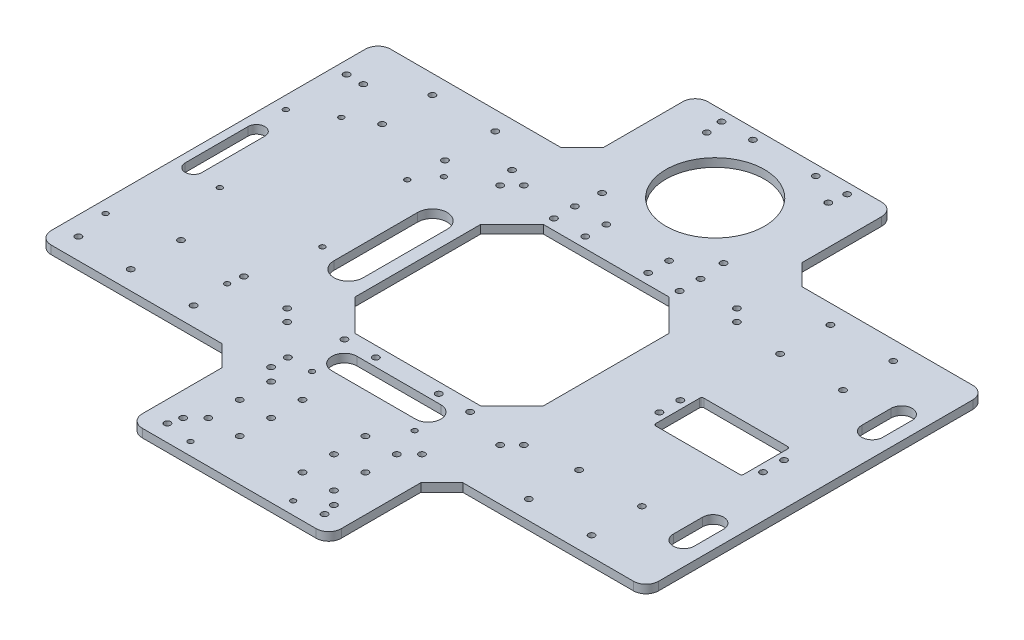
from build123d import *

# Parameters (mm, degrees)
EXTRUDE_1_DEPTH      = 4
SKETCH_2_R           = 1.5
CUT_EXTRUDE_1_DEPTH  = 4
SKETCH_3_R           = 23.5
SKETCH_3_R_2         = 1.5
CUT_EXTRUDE_2_DEPTH  = 4
SKETCH_4_W           = 90
SKETCH_4_H           = 90
CUT_EXTRUDE_3_DEPTH  = 4
FILLET_3_R           = 6
CHAMFER_1_SIZE       = 10
CUT_EXTRUDE_6_DEPTH  = 4
CHAMFER_2_SIZE       = 15
SKETCH_8_R           = 1.5
CUT_EXTRUDE_7_DEPTH  = 4
SKETCH_9_R           = 1.5
CUT_EXTRUDE_8_DEPTH  = 4
CUT_EXTRUDE_9_DEPTH  = 10
SKETCH_14_R          = 1.5
SKETCH_14_R_2        = 1.25
CUT_EXTRUDE_10_DEPTH = 10
SKETCH_15_R          = 1.5
SKETCH_15_W          = 42
SKETCH_15_H          = 23
CUT_EXTRUDE_11_DEPTH = 10
FILLET_4_R           = 1
SKETCH_16_R          = 1.25
CUT_EXTRUDE_12_DEPTH = 10
SKETCH_23_R          = 1.25
CUT_EXTRUDE_14_DEPTH = 10
SKETCH_24_R          = 1.5
CUT_EXTRUDE_15_DEPTH = 10
SKETCH_20_R          = 1.5
CUT_EXTRUDE_16_DEPTH = 10
SKETCH_26_R          = 1.5
CUT_EXTRUDE_17_DEPTH = 10


with BuildPart() as part:
    # 草图1 → 凸台-拉伸1 (new body)
    with BuildSketch(Plane(origin=(0, 0, 0), x_dir=(1, 0, 0), z_dir=(0, 1, 0))):
        Polygon((-47.5, -81), (-47.5, -135), (47.5, -135), (47.5, -81), (145, -81), (145, 81), (47.5, 81), (47.5, 135), (-47.5, 135), (-47.5, 81), (-145, 81), (-145, -81), align=None)
    extrude(amount=EXTRUDE_1_DEPTH)

    # 草图2 → 切除-拉伸1 (cut)
    with BuildSketch(Plane(origin=(0, 4, 0), x_dir=(1, 0, 0), z_dir=(0, 1, 0))):
        with Locations(Location((110, 72, 0), (0, 0, 270))):
            Circle(SKETCH_2_R)
        with Locations(Location((80, 72, 0), (0, 0, 270))):
            Circle(SKETCH_2_R)
        with Locations(Location((80, 48, 0), (0, 0, 270))):
            Circle(SKETCH_2_R)
        with Locations(Location((110, 48, 0), (0, 0, 270))):
            Circle(SKETCH_2_R)
        with Locations(Location((110, -48, 0), (0, 0, 90))):
            Circle(SKETCH_2_R)
        with Locations(Location((110, -72, 0), (0, 0, 90))):
            Circle(SKETCH_2_R)
        with Locations(Location((80, -48, 0), (0, 0, 90))):
            Circle(SKETCH_2_R)
        with Locations(Location((80, -72, 0), (0, 0, 90))):
            Circle(SKETCH_2_R)
        with Locations(Location((-80, -72, 0), (0, 0, 270))):
            Circle(SKETCH_2_R)
        with Locations(Location((-80, -48, 0), (0, 0, 270))):
            Circle(SKETCH_2_R)
        with Locations(Location((-110, -72, 0), (0, 0, 270))):
            Circle(SKETCH_2_R)
        with Locations(Location((-110, -48, 0), (0, 0, 270))):
            Circle(SKETCH_2_R)
        with Locations(Location((-110, 48, 0), (0, 0, 90))):
            Circle(SKETCH_2_R)
        with Locations(Location((-80, 48, 0), (0, 0, 90))):
            Circle(SKETCH_2_R)
        with Locations(Location((-80, 72, 0), (0, 0, 90))):
            Circle(SKETCH_2_R)
        with Locations(Location((-110, 72, 0), (0, 0, 90))):
            Circle(SKETCH_2_R)
    extrude(amount=-CUT_EXTRUDE_1_DEPTH, mode=Mode.SUBTRACT)

    # 草图3 → 切除-拉伸2 (cut)
    with BuildSketch(Plane(origin=(0, 4, 0), x_dir=(1, 0, 0), z_dir=(0, 1, 0))):
        with Locations(Location((0, 97, 0), (0, 0, 270))):
            Circle(SKETCH_3_R)
        with Locations(Location((29, 122, 0), (0, 0, 270))):
            Circle(SKETCH_3_R_2)
        with Locations(Location((29, 72, 0), (0, 0, 90))):
            Circle(SKETCH_3_R_2)
        with Locations(Location((-29, 72, 0), (0, 0, 270))):
            Circle(SKETCH_3_R_2)
        with Locations(Location((-29, 122, 0), (0, 0, 90))):
            Circle(SKETCH_3_R_2)
    extrude(amount=-CUT_EXTRUDE_2_DEPTH, mode=Mode.SUBTRACT)

    # 草图4 → 切除-拉伸3 (cut)
    with BuildSketch(Plane(origin=(0, 4, 0), x_dir=(1, 0, 0), z_dir=(0, 1, 0))):
        Rectangle(SKETCH_4_W, SKETCH_4_H)
    extrude(amount=-CUT_EXTRUDE_3_DEPTH, mode=Mode.SUBTRACT)

    # 圆角3
    fillet_3_edges = [part.edges().sort_by_distance(p)[0] for p in [
        (-145, 2, 81),
        (-145, 2, -81),
        (-47.5, 2, -135),
        (47.5, 2, -135),
        (145, 2, -81),
        (145, 2, 81),
        (47.5, 2, 135),
        (-47.5, 2, 135),
    ]]
    fillet(fillet_3_edges, radius=FILLET_3_R)

    # 倒角1
    chamfer_1_edges = [part.edges().sort_by_distance(p)[0] for p in [
        (-47.5, 2, 81),
        (-47.5, 2, -81),
        (47.5, 2, -81),
        (47.5, 2, 81),
    ]]
    chamfer(chamfer_1_edges, length=CHAMFER_1_SIZE)

    # 草图7 → 切除-拉伸6 (cut)
    with BuildSketch(Plane(origin=(0, 4, 0), x_dir=(1, 0, 0), z_dir=(0, 1, 0))):
        with BuildLine():
            Line((-65, -20), (-65, 20))
            ThreePointArc((-65, 20), (-58, 27), (-51, 20))
            Line((-51, 20), (-51, -20))
            ThreePointArc((-51, -20), (-58, -27), (-65, -20))
        make_face()
        with BuildLine():
            Line((-141, -15), (-141, 15))
            ThreePointArc((-141, 15), (-137, 19), (-133, 15))
            Line((-133, 15), (-133, -15))
            ThreePointArc((-133, -15), (-137, -19), (-141, -15))
        make_face()
        with BuildLine():
            Line((129, 38), (129, 52))
            ThreePointArc((129, 52), (134, 57), (139, 52))
            Line((139, 52), (139, 38))
            ThreePointArc((139, 38), (134, 33), (129, 38))
        make_face()
        with BuildLine():
            Line((129, -38), (129, -52))
            ThreePointArc((129, -52), (134, -57), (139, -52))
            Line((139, -52), (139, -38))
            ThreePointArc((139, -38), (134, -33), (129, -38))
        make_face()
    extrude(amount=-CUT_EXTRUDE_6_DEPTH, mode=Mode.SUBTRACT)

    # 倒角2
    chamfer_2_edges = [part.edges().sort_by_distance(p)[0] for p in [
        (45, 2, -45),
        (45, 2, 45),
        (-45, 2, 45),
        (-45, 2, -45),
    ]]
    chamfer(chamfer_2_edges, length=CHAMFER_2_SIZE)

    # 草图8 → 切除-拉伸7 (cut)
    with BuildSketch(Plane(origin=(0, 4, 0), x_dir=(1, 0, 0), z_dir=(0, 1, 0))):
        with Locations(Location((-139, 60, 0), (0, 0, 270))):
            Circle(SKETCH_8_R)
        with Locations(Location((-131, 60, 0), (0, 0, 270))):
            Circle(SKETCH_8_R)
    extrude(amount=-CUT_EXTRUDE_7_DEPTH, mode=Mode.SUBTRACT)

    # 草图9 → 切除-拉伸8 (cut)
    with BuildSketch(Plane(origin=(0, 4, 0), x_dir=(1, 0, 0), z_dir=(0, 1, 0))):
        with Locations(Location((50.843145751, 56.5, 0), (0, 0, 270))):
            Circle(SKETCH_9_R)
        with Locations(Location((56.5, 50.843145751, 0), (0, 0, 270))):
            Circle(SKETCH_9_R)
        with Locations(Location((56.5, -50.843145751, 0), (0, 0, 90))):
            Circle(SKETCH_9_R)
        with Locations(Location((50.843145751, -56.5, 0), (0, 0, 90))):
            Circle(SKETCH_9_R)
        with Locations(Location((-50.843145751, -56.5, 0), (0, 0, 270))):
            Circle(SKETCH_9_R)
        with Locations(Location((-56.5, -50.843145751, 0), (0, 0, 270))):
            Circle(SKETCH_9_R)
        with Locations(Location((-56.5, 50.843145751, 0), (0, 0, 90))):
            Circle(SKETCH_9_R)
        with Locations(Location((-50.843145751, 56.5, 0), (0, 0, 90))):
            Circle(SKETCH_9_R)
        with Locations(Location((-37.5, -127, 0), (0, 0, 270))):
            Circle(SKETCH_9_R)
        with Locations(Location((37.5, -127, 0), (0, 0, 90))):
            Circle(SKETCH_9_R)
    extrude(amount=-CUT_EXTRUDE_8_DEPTH, mode=Mode.SUBTRACT)

    # 草图12 → 切除-拉伸9 (cut)
    with BuildSketch(Plane(origin=(0, 4, 0), x_dir=(1, 0, 0), z_dir=(0, 1, 0))):
        with BuildLine():
            Line((-20, -54), (20, -54))
            ThreePointArc((20, -54), (26, -60), (20, -66))
            Line((20, -66), (-20, -66))
            ThreePointArc((-20, -66), (-26, -60), (-20, -54))
        make_face()
    extrude(amount=-CUT_EXTRUDE_9_DEPTH, mode=Mode.SUBTRACT)

    # 草图14 → 切除-拉伸10 (cut)
    with BuildSketch(Plane(origin=(0, 4, 0), x_dir=(1, 0, 0), z_dir=(0, 1, 0))):
        with Locations(Location((36, -79, 0), (0, 0, 270))):
            Circle(SKETCH_14_R)
        with Locations(Location((36, -121, 0), (0, 0, 270))):
            Circle(SKETCH_14_R)
        with Locations(Location((-36, -121, 0), (0, 0, 270))):
            Circle(SKETCH_14_R)
        with Locations(Location((-36, -79, 0), (0, 0, 270))):
            Circle(SKETCH_14_R)
        with Locations(Location((-24.5, -71, 0), (0, 0, 270))):
            Circle(SKETCH_14_R_2)
        with Locations(Location((24.5, -71, 0), (0, 0, 270))):
            Circle(SKETCH_14_R_2)
        with Locations(Location((24.5, -129, 0), (0, 0, 270))):
            Circle(SKETCH_14_R_2)
        with Locations(Location((-24.5, -129, 0), (0, 0, 270))):
            Circle(SKETCH_14_R_2)
    extrude(amount=-CUT_EXTRUDE_10_DEPTH, mode=Mode.SUBTRACT)

    # 草图15 → 切除-拉伸11 (cut)
    with BuildSketch(Plane(origin=(0, 4, 0), x_dir=(1, 0, 0), z_dir=(0, 1, 0))):
        with Locations(Location((75.36, 5, 0), (0, 0, 270))):
            Circle(SKETCH_15_R)
        with Locations(Location((75.36, -5, 0), (0, 0, 270))):
            Circle(SKETCH_15_R)
        with Locations(Location((124.86, -5, 0), (0, 0, 270))):
            Circle(SKETCH_15_R)
        with Locations(Location((124.86, 5, 0), (0, 0, 270))):
            Circle(SKETCH_15_R)
        with Locations((100.11, 0)):
            Rectangle(SKETCH_15_W, SKETCH_15_H)
    extrude(amount=-CUT_EXTRUDE_11_DEPTH, mode=Mode.SUBTRACT)

    # 圆角4
    fillet_4_edges = [part.edges().sort_by_distance(p)[0] for p in [
        (121.11, 2, -11.5),
        (121.11, 2, 11.5),
        (79.11, 2, 11.5),
        (79.11, 2, -11.5),
    ]]
    fillet(fillet_4_edges, radius=FILLET_4_R)

    # 草图16 → 切除-拉伸12 (cut)
    with BuildSketch(Plane(origin=(0, 4, 0), x_dir=(1, 0, 0), z_dir=(0, 1, 0))):
        with Locations(Location((-73.5, 41, 0), (0, 0, 270))):
            Circle(SKETCH_16_R)
        with Locations(Location((-122.5, 41, 0), (0, 0, 270))):
            Circle(SKETCH_16_R)
        with Locations(Location((-73.5, -17, 0), (0, 0, 270))):
            Circle(SKETCH_16_R)
        with Locations(Location((-122.5, -17, 0), (0, 0, 270))):
            Circle(SKETCH_16_R)
    extrude(amount=-CUT_EXTRUDE_12_DEPTH, mode=Mode.SUBTRACT)

    # 草图23 → 切除-拉伸14 (cut)
    with BuildSketch(Plane(origin=(0, 4, 0), x_dir=(1, 0, 0), z_dir=(0, 1, 0))):
        with Locations(Location((-81, 31, 0), (0, 0, 270))):
            Circle(SKETCH_23_R)
        with Locations(Location((-139, 31, 0), (0, 0, 270))):
            Circle(SKETCH_23_R)
        with Locations(Location((-81, -55, 0), (0, 0, 270))):
            Circle(SKETCH_23_R)
        with Locations(Location((-139, -55, 0), (0, 0, 270))):
            Circle(SKETCH_23_R)
    extrude(amount=-CUT_EXTRUDE_14_DEPTH, mode=Mode.SUBTRACT)

    # 草图24 → 切除-拉伸15 (cut)
    with BuildSketch(Plane(origin=(0, 4, 0), x_dir=(1, 0, 0), z_dir=(0, 1, 0))):
        with Locations(Location((-136, -71, 0), (0, 0, 270))):
            Circle(SKETCH_24_R)
        with Locations(Location((-36, -71, 0), (0, 0, 270))):
            Circle(SKETCH_24_R)
        with Locations(Location((-36, -121, 0), (0, 0, 270))):
            Circle(SKETCH_24_R)
    extrude(amount=-CUT_EXTRUDE_15_DEPTH, mode=Mode.SUBTRACT)

    # 草图20 → 切除-拉伸16 (cut)
    with BuildSketch(Plane(origin=(0, 4, 0), x_dir=(1, 0, 0), z_dir=(0, 1, 0))):
        with Locations(Location((-60, 60, 0), (0, 0, 270))):
            Circle(SKETCH_20_R)
    extrude(amount=-CUT_EXTRUDE_16_DEPTH, mode=Mode.SUBTRACT)

    # 草图26 → 切除-拉伸17 (cut)
    with BuildSketch(Plane(origin=(0, 4, 0), x_dir=(1, 0, 0), z_dir=(0, 1, 0))):
        with Locations(Location((-30, -115, 0), (0, 0, 270))):
            Circle(SKETCH_26_R)
        with Locations(Location((-30, -100, 0), (0, 0, 270))):
            Circle(SKETCH_26_R)
        with Locations(Location((-15, -100, 0), (0, 0, 270))):
            Circle(SKETCH_26_R)
        with Locations(Location((-15, -115, 0), (0, 0, 270))):
            Circle(SKETCH_26_R)
        with Locations(Location((15, -115, 0), (0, 0, 270))):
            Circle(SKETCH_26_R)
        with Locations(Location((30, -115, 0), (0, 0, 270))):
            Circle(SKETCH_26_R)
        with Locations(Location((15, -100, 0), (0, 0, 270))):
            Circle(SKETCH_26_R)
        with Locations(Location((30, -100, 0), (0, 0, 270))):
            Circle(SKETCH_26_R)
        with Locations(Location((-30, -85, 0), (0, 0, 270))):
            Circle(SKETCH_26_R)
        with Locations(Location((-15, -85, 0), (0, 0, 270))):
            Circle(SKETCH_26_R)
        with Locations(Location((15, -85, 0), (0, 0, 270))):
            Circle(SKETCH_26_R)
        with Locations(Location((30, -85, 0), (0, 0, 270))):
            Circle(SKETCH_26_R)
        with Locations(Location((-30, -50, 0), (0, 0, 270))):
            Circle(SKETCH_26_R)
        with Locations(Location((-15, -50, 0), (0, 0, 270))):
            Circle(SKETCH_26_R)
        with Locations(Location((15, -50, 0), (0, 0, 270))):
            Circle(SKETCH_26_R)
        with Locations(Location((30, -50, 0), (0, 0, 270))):
            Circle(SKETCH_26_R)
        with Locations(Location((-30, 50, 0), (0, 0, 270))):
            Circle(SKETCH_26_R)
        with Locations(Location((-15, 50, 0), (0, 0, 270))):
            Circle(SKETCH_26_R)
        with Locations(Location((15, 50, 0), (0, 0, 270))):
            Circle(SKETCH_26_R)
        with Locations(Location((30, 50, 0), (0, 0, 270))):
            Circle(SKETCH_26_R)
        with Locations(Location((-30, 60, 0), (0, 0, 270))):
            Circle(SKETCH_26_R)
        with Locations(Location((-15, 60, 0), (0, 0, 270))):
            Circle(SKETCH_26_R)
        with Locations(Location((15, 60, 0), (0, 0, 270))):
            Circle(SKETCH_26_R)
        with Locations(Location((30, 60, 0), (0, 0, 270))):
            Circle(SKETCH_26_R)
        with Locations(Location((-30, 130, 0), (0, 0, 270))):
            Circle(SKETCH_26_R)
        with Locations(Location((-15, 130, 0), (0, 0, 270))):
            Circle(SKETCH_26_R)
        with Locations(Location((15, 130, 0), (0, 0, 270))):
            Circle(SKETCH_26_R)
        with Locations(Location((30, 130, 0), (0, 0, 270))):
            Circle(SKETCH_26_R)
    extrude(amount=-CUT_EXTRUDE_17_DEPTH, mode=Mode.SUBTRACT)


solid = part.part
